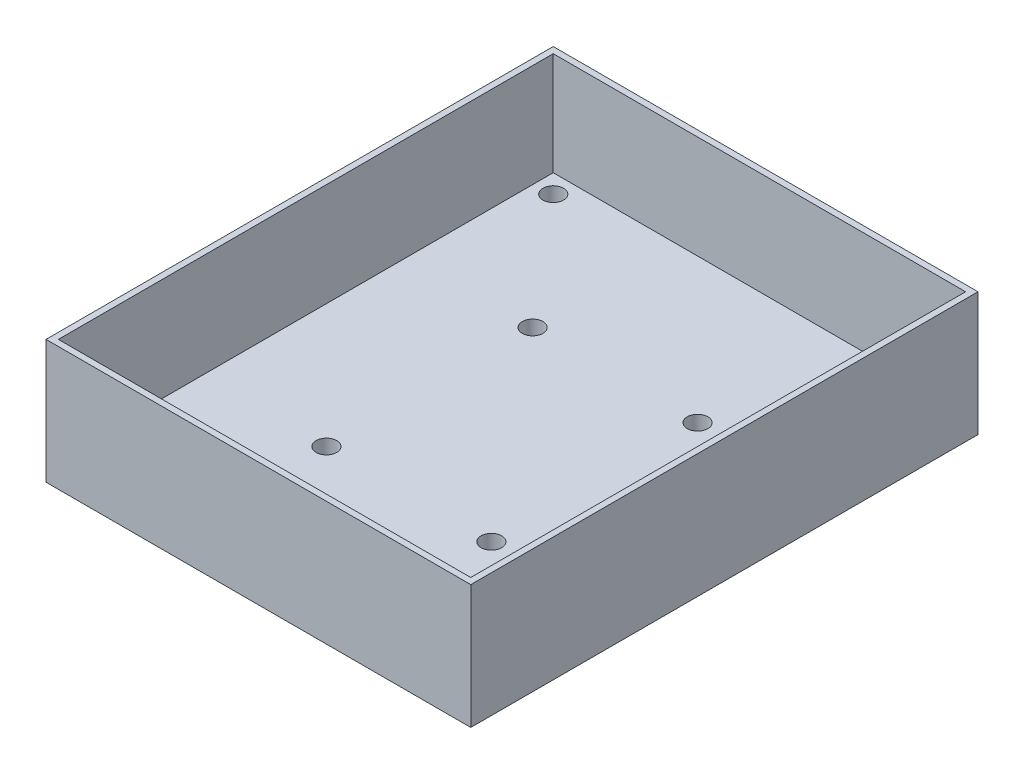
from build123d import *

# Parameters (mm, degrees)
SKETCH1_W           = 206
SKETCH1_H           = 246
BOSS_EXTRUDE1_DEPTH = 60
SKETCH2_W           = 200
SKETCH2_H           = 240
CUT_EXTRUDE1_DEPTH  = 50
CUT_EXTRUDE3_DEPTH  = 172.283390905
SKETCH4_R           = 5
CUT_EXTRUDE4_DEPTH  = 10


with BuildPart() as part:
    # Sketch1 → Boss-Extrude1 (new body)
    with BuildSketch(Plane(origin=(0, 0, 0), x_dir=(1, 0, 0), z_dir=(0, 1, 0))):
        Rectangle(SKETCH1_W, SKETCH1_H)
    extrude(amount=BOSS_EXTRUDE1_DEPTH)

    # Sketch2 → Cut-Extrude1 (cut)
    with BuildSketch(Plane(origin=(0, 60, 0), x_dir=(1, 0, 0), z_dir=(0, 1, 0))):
        Rectangle(SKETCH2_W, SKETCH2_H)
    extrude(amount=-CUT_EXTRUDE1_DEPTH, mode=Mode.SUBTRACT)

    # Sketch3 → Cut-Extrude3 (cut, through all)
    with BuildSketch(Plane.XZ):
        with BuildLine():
            Line((-91, 106), (-91, 111))
            Line((-91, 111), (-86, 111))
            ThreePointArc((-86, 111), (-94.535533906, 114.535533906), (-91, 106))
        make_face()
        with BuildLine():
            Line((-86, 111), (-91, 111))
            Line((-91, 111), (-91, 106))
            ThreePointArc((-91, 106), (-87.464466094, 107.464466094), (-86, 111))
        make_face()
        with BuildLine():
            ThreePointArc((96, 111), (91, 116), (86, 111))
            Line((86, 111), (91, 111))
            Line((91, 111), (91, 106))
            ThreePointArc((91, 106), (94.535533906, 107.464466094), (96, 111))
        make_face()
        with BuildLine():
            Line((91, 111), (86, 111))
            ThreePointArc((86, 111), (87.464466094, 107.464466094), (91, 106))
            Line((91, 106), (91, 111))
        make_face()
        with BuildLine():
            ThreePointArc((96, -111), (94.535533906, -107.464466094), (91, -106))
            Line((91, -106), (91, -111))
            Line((91, -111), (86, -111))
            ThreePointArc((86, -111), (91, -116), (96, -111))
        make_face()
        with BuildLine():
            Line((91, -111), (91, -106))
            ThreePointArc((91, -106), (87.464466094, -107.464466094), (86, -111))
            Line((86, -111), (91, -111))
        make_face()
        with BuildLine():
            ThreePointArc((-86, -111), (-87.464466094, -107.464466094), (-91, -106))
            Line((-91, -106), (-91, -111))
            Line((-91, -111), (-86, -111))
        make_face()
        with BuildLine():
            Line((-91, -111), (-91, -106))
            ThreePointArc((-91, -106), (-94.535533906, -114.535533906), (-86, -111))
            Line((-86, -111), (-91, -111))
        make_face()
    extrude(amount=-CUT_EXTRUDE3_DEPTH, mode=Mode.SUBTRACT)

    # Sketch4 → Cut-Extrude4 (cut)
    with BuildSketch(Plane.XZ):
        with Locations(Location((40, -50, 0), (0, 0, 270))):
            Circle(SKETCH4_R)
        with Locations(Location((-40, -50, 0), (0, 0, 270))):
            Circle(SKETCH4_R)
        with Locations(Location((-40, 50, 0), (0, 0, 270))):
            Circle(SKETCH4_R)
        with Locations(Location((40, 50, 0), (0, 0, 270))):
            Circle(SKETCH4_R)
    extrude(amount=-CUT_EXTRUDE4_DEPTH, mode=Mode.SUBTRACT)


solid = part.part
